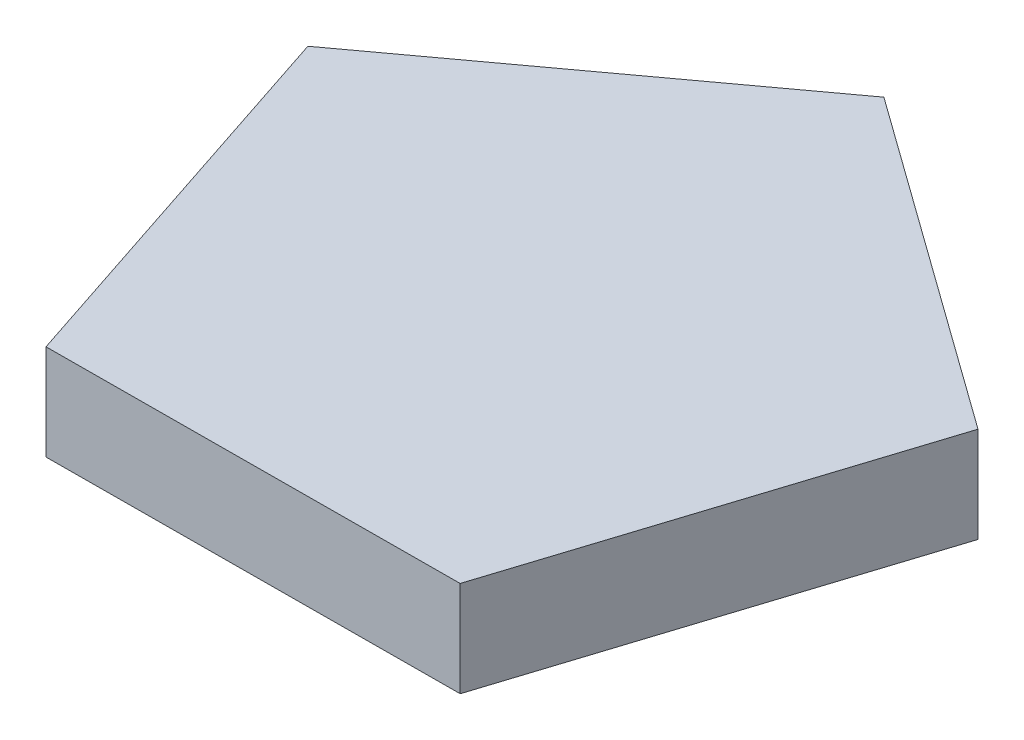
from build123d import *

# Parameters (mm, degrees)
EXTRUDE_1_DEPTH = 10


with BuildPart() as part:
    # 草图1 → 凸台-拉伸1 (new body)
    with BuildSketch(Plane(origin=(0, 0, 0), x_dir=(1, 0, 0), z_dir=(0, 1, 0))):
        Polygon((3.17402861, -14.032547539), (16.289317406, 27.052970711), (-18.732485327, 52.222474944), (-53.492438559, 26.692565791), (-39.953468371, -14.255290029), align=None)
    extrude(amount=EXTRUDE_1_DEPTH)


solid = part.part
